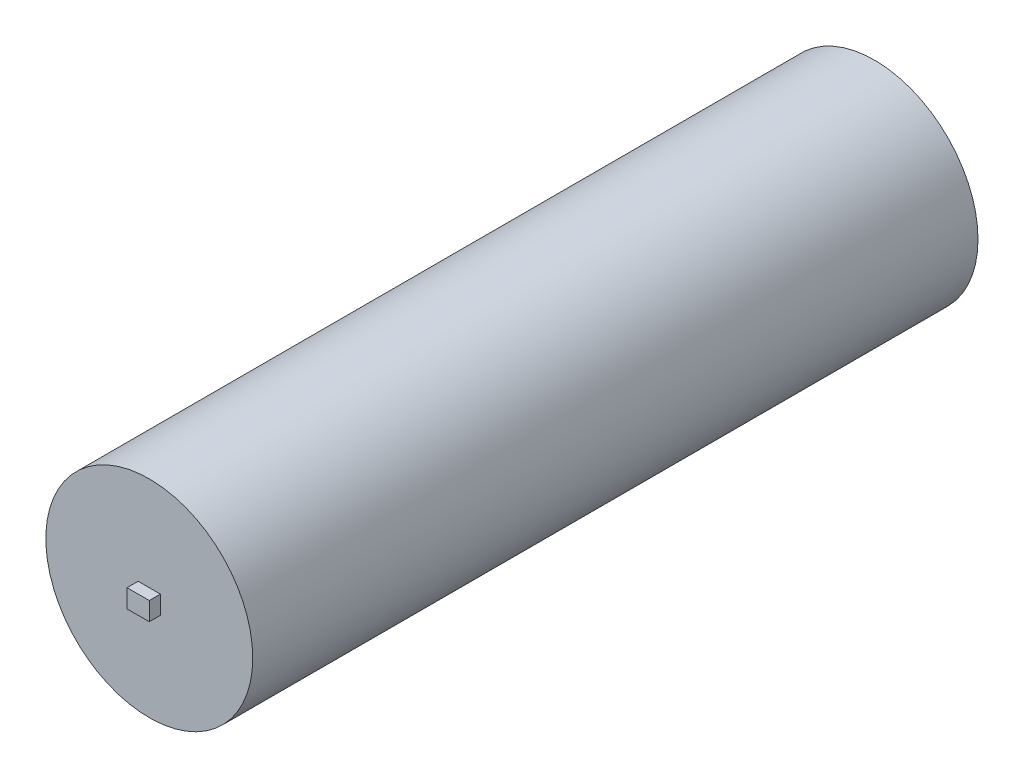
from build123d import *

# Parameters (mm, degrees)
SKETCH_1_R      = 9.3
EXTRUDE_1_DEPTH = 32.6
SKETCH_2_W      = 2
SKETCH_2_H      = 1.651721756
EXTRUDE_2_DEPTH = 1


with BuildPart() as part:
    # Эскиз1 → Бобышка-Вытянуть1 (new, symmetric)
    with BuildSketch(Plane.XY):
        Circle(SKETCH_1_R)
    extrude(amount=EXTRUDE_1_DEPTH, both=True)

    # Эскиз2 → Бобышка-Вытянуть2 (add)
    with BuildSketch(Plane.XY.offset(32.6)):
        Rectangle(SKETCH_2_W, SKETCH_2_H)
    extrude(amount=EXTRUDE_2_DEPTH)


solid = part.part
